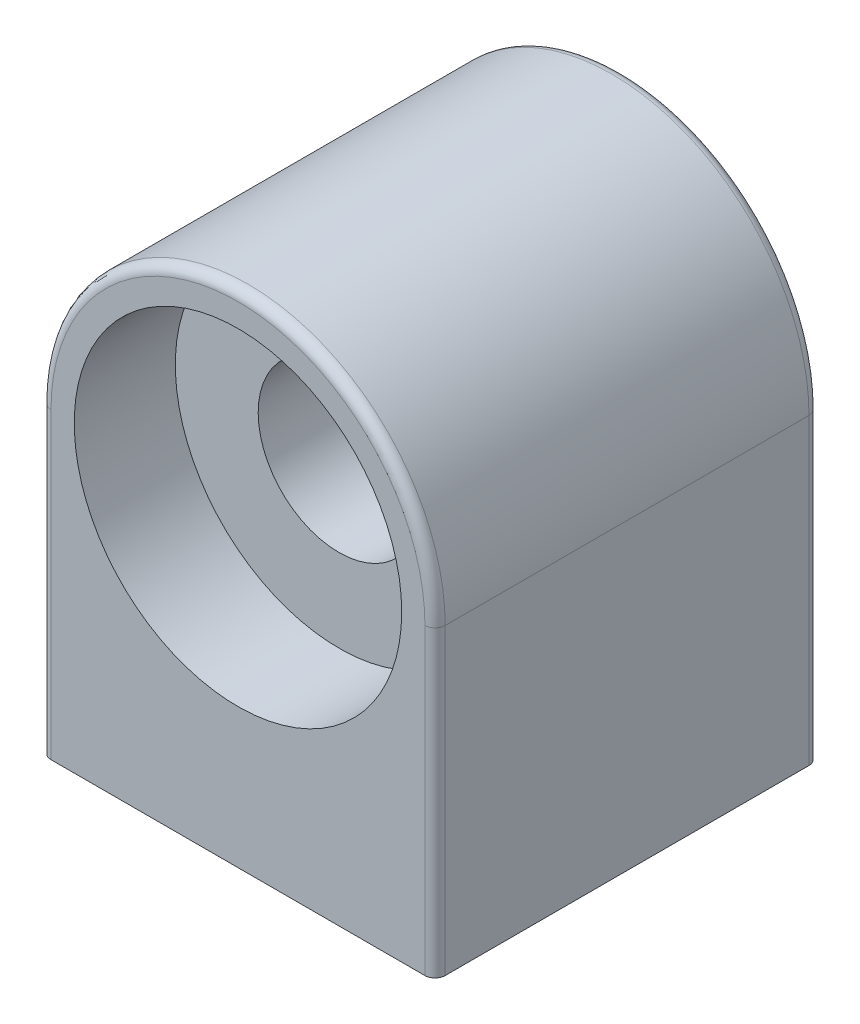
from build123d import *

# Parameters (mm, degrees)
BOSS_EXTRUDE2_DEPTH = 9.5
SKETCH4_R           = 4
CUT_EXTRUDE1_DEPTH  = 27.097174177
SKETCH9_R           = 8.1
CUT_EXTRUDE3_DEPTH  = 5
CUT_EXTRUDE4_START  = -5
SKETCH10_R          = 8.1
CUT_EXTRUDE4_DEPTH  = 5
SKETCH12_R          = 2.55
CUT_EXTRUDE6_DEPTH  = 8
FILLET1_R           = 0.5


with BuildPart() as part:
    # Sketch3 → Boss-Extrude2 (new, symmetric)
    with BuildSketch(Plane.XY):
        with BuildLine():
            Line((9.75, 0), (9.75, -15))
            Line((9.75, -15), (-9.75, -15))
            Line((-9.75, -15), (-9.75, 0))
            ThreePointArc((-9.75, 0), (0, 9.75), (9.75, 0))
        make_face()
    extrude(amount=BOSS_EXTRUDE2_DEPTH, both=True)

    # Sketch4 → Cut-Extrude1 (cut, through all)
    with BuildSketch(Plane(origin=(0, 0, -9.5), x_dir=(-1, 0, 0), z_dir=(0, 0, -1))):
        Circle(SKETCH4_R)
    extrude(amount=-CUT_EXTRUDE1_DEPTH, mode=Mode.SUBTRACT)

    # Sketch9 → Cut-Extrude3 (cut)
    with BuildSketch(Plane(origin=(0, 0, -9.5), x_dir=(-1, 0, 0), z_dir=(0, 0, -1))):
        Circle(SKETCH9_R)
    extrude(amount=-CUT_EXTRUDE3_DEPTH, mode=Mode.SUBTRACT)

    # Sketch10 → Cut-Extrude4 (cut)
    with BuildSketch(Plane.XY.offset(9.5).offset(CUT_EXTRUDE4_START)):
        with Locations(Location((0, 0, 0), (0, 0, 180))):
            Circle(SKETCH10_R)
    extrude(amount=CUT_EXTRUDE4_DEPTH, mode=Mode.SUBTRACT)

    # Sketch12 → Cut-Extrude6 (cut)
    with BuildSketch(Plane.XZ.offset(15)):
        with Locations(Location((0, 0, 0), (0, 0, 270))):
            Circle(SKETCH12_R)
    extrude(amount=-CUT_EXTRUDE6_DEPTH, mode=Mode.SUBTRACT)

    # Fillet1
    fillet1_edges = [part.edges().sort_by_distance(p)[0] for p in [
        (9.75, -7.5, 9.5),
        (0, 9.75, 9.5),
        (9.75, -7.5, -9.5),
        (-9.75, -7.5, -9.5),
        (0, 9.75, -9.5),
        (-9.75, -7.5, 9.5),
    ]]
    fillet(fillet1_edges, radius=FILLET1_R)


solid = part.part
